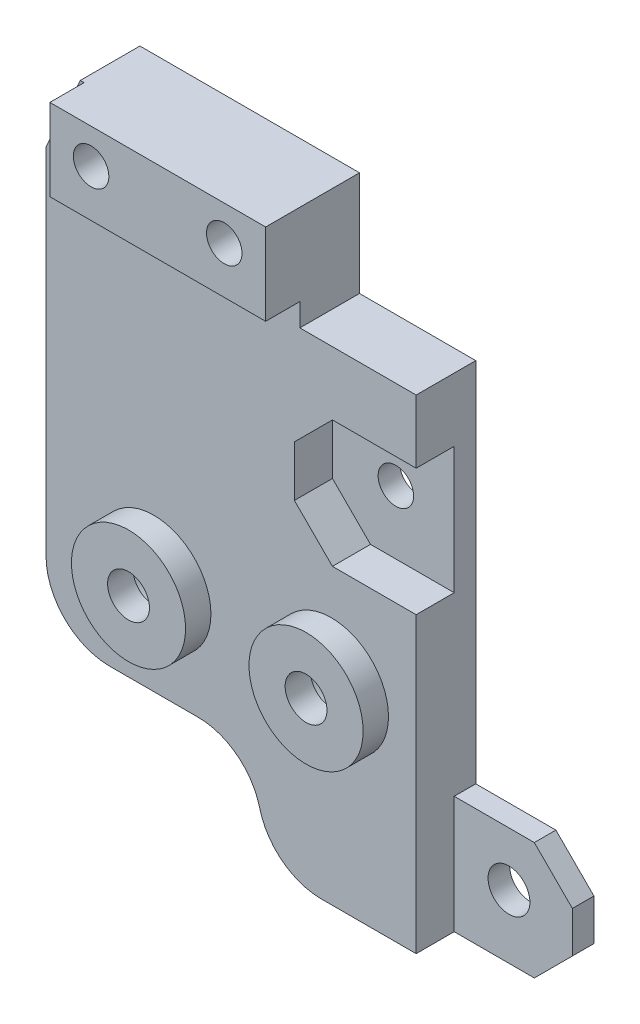
from build123d import *

# Parameters (mm, degrees)
SKETCH2_R           = 1.4
SKETCH2_R_2         = 1.65
BOSS_EXTRUDE1_DEPTH = 4.7
SKETCH3_R           = 4.5
SKETCH3_R_2         = 1.65
BOSS_EXTRUDE2_DEPTH = 2
FILLET1_R           = 5
CHAMFER1_SIZE       = 3
CUT_EXTRUDE1_DEPTH  = 3
BOSS_EXTRUDE3_START = -4.7
SKETCH5_R           = 1.4
BOSS_EXTRUDE3_DEPTH = 4.7
BOSS_EXTRUDE4_START = 2.7
SKETCH6_W           = 17.015251106
SKETCH6_H           = 6.441411174
SKETCH6_R           = 1.4
BOSS_EXTRUDE4_DEPTH = 2.7


with BuildPart() as part:
    # Sketch2 → Boss-Extrude1 (new body)
    with BuildSketch(Plane.XY):
        with BuildLine():
            Line((5.681498191, -33.388801204), (5.681498191, -42.638801204))
            Line((5.681498191, -42.638801204), (-15.818501809, -42.638801204))
            Line((-15.818501809, -42.638801204), (-15.818501809, -40.088801204))
            ThreePointArc((-15.818501809, -40.088801204), (-17.282967903, -36.553267298), (-20.818501809, -35.088801204))
            Line((-20.818501809, -35.088801204), (-32.818501809, -35.088801204))
            Line((-32.818501809, -35.088801204), (-32.818501809, -4.488801204))
            Line((-32.818501809, -4.488801204), (-12.818501809, -4.488801204))
            Line((-12.818501809, -4.488801204), (-3.637114605, -4.488801204))
            Line((-3.637114605, -4.488801204), (-3.637114605, -4.888801204))
            Line((-3.637114605, -4.888801204), (-3.637114605, -9.488801204))
            Line((-3.637114605, -9.488801204), (-3.637114605, -33.388801204))
            Line((-3.637114605, -33.388801204), (5.681498191, -33.388801204))
        make_face()
        with Locations((-8.237114605, -14.488801204)):
            Circle(SKETCH2_R, mode=Mode.SUBTRACT)
        with Locations((0.681498191, -37.638801204)):
            Circle(SKETCH2_R_2, mode=Mode.SUBTRACT)
        with BuildLine():
            ThreePointArc((-27.418501809, -27.538801204), (-26.510532831, -29.730832226), (-24.318501809, -30.638801204))
            ThreePointArc((-24.318501809, -30.638801204), (-22.126470787, -25.346770182), (-27.418501809, -27.538801204))
        make_face(mode=Mode.SUBTRACT)
        with BuildLine():
            ThreePointArc((-13.418501809, -27.538801204), (-12.510532831, -29.730832226), (-10.318501809, -30.638801204))
            ThreePointArc((-10.318501809, -30.638801204), (-8.126470787, -25.346770182), (-13.418501809, -27.538801204))
        make_face(mode=Mode.SUBTRACT)
    extrude(amount=BOSS_EXTRUDE1_DEPTH)

    # Sketch3 → Boss-Extrude2 (add)
    # profile 1 of 2: a face of its own
    with BuildSketch(Plane.XY.offset(4.7)):
        with Locations((-24.318501809, -27.538801204)):
            Circle(SKETCH3_R)
        with Locations((-24.318501809, -27.538801204)):
            Circle(SKETCH3_R_2, mode=Mode.SUBTRACT)
    # profile 2 of 2: a face of its own
    with BuildSketch(Plane.XY.offset(4.7)):
        with Locations((-10.318501809, -27.538801204)):
            Circle(SKETCH3_R)
        with Locations((-10.318501809, -27.538801204)):
            Circle(SKETCH3_R_2, mode=Mode.SUBTRACT)
    extrude(amount=BOSS_EXTRUDE2_DEPTH)

    # Fillet1
    fillet1_edges = [part.edges().sort_by_distance(p)[0] for p in [
        (-15.818501809, -42.638801204, 2.35),
        (-32.818501809, -35.088801204, 2.35),
        (-32.818501809, -4.488801204, 2.35),
    ]]
    fillet(fillet1_edges, radius=FILLET1_R)

    # Chamfer1
    chamfer1_edges = [part.edges().sort_by_distance(p)[0] for p in [
        (5.681498191, -33.388801204, 2.35),
        (5.681498191, -42.638801204, 2.35),
    ]]
    chamfer(chamfer1_edges, length=CHAMFER1_SIZE)

    # Sketch4 → Cut-Extrude1 (cut)
    with BuildSketch(Plane.XY.offset(4.7)):
        Polygon((-3.637114605, -42.638801204), (2.681498191, -42.638801204), (5.681498191, -39.638801204), (5.681498191, -36.388801204), (2.681498191, -33.388801204), (-3.637114605, -33.388801204), align=None)
        Polygon((-3.637114605, -9.488801204), (-10.237114605, -9.488801204), (-13.237114605, -12.488801204), (-13.237114605, -16.488801204), (-10.237114605, -19.488801204), (-3.637114605, -19.488801204), align=None)
    extrude(amount=-CUT_EXTRUDE1_DEPTH, mode=Mode.SUBTRACT)

    # Sketch5 → Boss-Extrude3 (add)
    with BuildSketch(Plane(origin=(0, 0, 0), x_dir=(-1, 0, 0), z_dir=(0, 0, -1)).offset(BOSS_EXTRUDE3_START)):
        with BuildLine():
            Line((12.803250703, -4.488801204), (12.803250703, 3.75260997))
            Line((12.803250703, 3.75260997), (30.118597337, 3.75260997))
            Line((30.118597337, 3.75260997), (32.818501809, -2.119551062))
            Line((32.818501809, -2.119551062), (32.818501809, -9.488801204))
            ThreePointArc((32.818501809, -9.488801204), (31.354035715, -5.953267298), (27.818501809, -4.488801204))
            Line((27.818501809, -4.488801204), (12.803250703, -4.488801204))
        make_face()
        with Locations((26.568501809, 1.011198796)):
            Circle(SKETCH5_R, mode=Mode.SUBTRACT)
        with Locations((16.068501809, 1.011198796)):
            Circle(SKETCH5_R, mode=Mode.SUBTRACT)
    extrude(amount=BOSS_EXTRUDE3_DEPTH)

    # Sketch6 → Boss-Extrude4 (add)
    with BuildSketch(Plane.XY.offset(4.7).offset(BOSS_EXTRUDE4_START)):
        with Locations((-21.310876256, 0.531904383)):
            Rectangle(SKETCH6_W, SKETCH6_H)
        with Locations(Location((-26.568501809, 1.011198796, 0), (0, 0, 180))):
            Circle(SKETCH6_R, mode=Mode.SUBTRACT)
        with Locations(Location((-16.068501809, 1.011198796, 0), (0, 0, 180))):
            Circle(SKETCH6_R, mode=Mode.SUBTRACT)
    extrude(amount=-BOSS_EXTRUDE4_DEPTH)


solid = part.part
